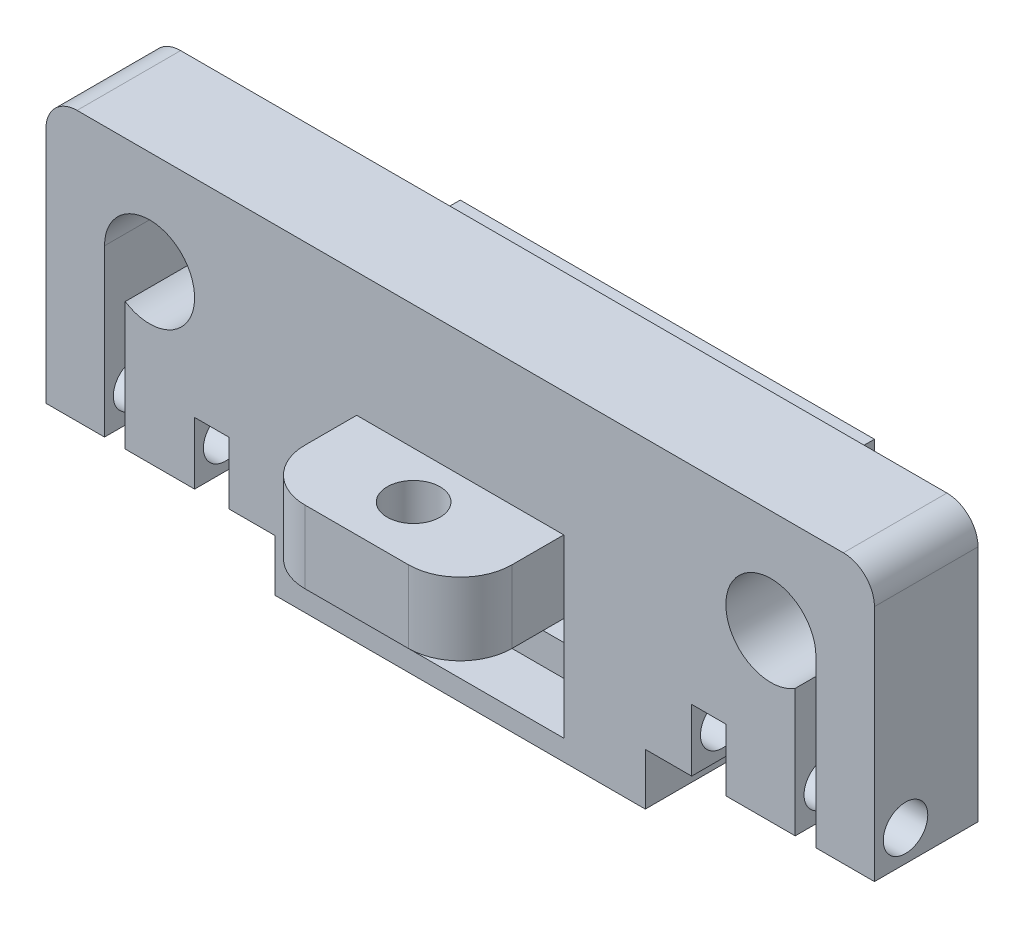
from build123d import *

# Parameters (mm, degrees)
BOSS_EXTRUDE1_DEPTH = 5
SKETCH2_W           = 3.3
SKETCH2_H           = 6
CUT_EXTRUDE2_DEPTH  = 6.5
SKETCH3_R           = 2.15
CUT_EXTRUDE4_DEPTH  = 24
FILLET1_R           = 0.5
FILLET2_R           = 3
SKETCH5_W           = 10.2
SKETCH5_H           = 7
CUT_EXTRUDE5_DEPTH  = 44.231932642
SKETCH8_W           = 20
SKETCH8_H           = 7
CUT_EXTRUDE6_DEPTH  = 44.231932642
SKETCH9_W           = 20
SKETCH9_H           = 7
BOSS_EXTRUDE2_DEPTH = 10
SKETCH10_R          = 2.55
CUT_EXTRUDE7_DEPTH  = 45.955533586
FILLET3_R           = 5
SKETCH11_W          = 40
SKETCH11_H          = 10
BOSS_EXTRUDE3_DEPTH = 10
SKETCH13_W          = 35.742737896
SKETCH13_H          = 10
BOSS_EXTRUDE5_DEPTH = 5
SKETCH14_R          = 1.4
CUT_EXTRUDE8_DEPTH  = 47.75467891
SKETCH16_W          = 20
SKETCH16_H          = 3
CUT_EXTRUDE10_DEPTH = 5
SKETCH17_R          = 1
CUT_EXTRUDE11_DEPTH = 3.5


with BuildPart() as part:
    # Sketch1 → Boss-Extrude1 (new, symmetric)
    with BuildSketch(Plane.XY):
        with BuildLine():
            Line((40, -13), (34.35, -13))
            Line((34.35, -13), (34.35, 3))
            ThreePointArc((34.35, 3), (26.182605601, 5.085665361), (32.35, -0.660601044))
            Line((32.35, -0.660601044), (32.35, -13))
            Line((32.35, -13), (7.5, -13))
            Line((7.5, -13), (7.5, -6))
            Line((7.5, -6), (5.1, -6))
            Line((5.1, -6), (5.1, -13))
            Line((5.1, -13), (-5.1, -13))
            Line((-5.1, -13), (-5.1, -6))
            Line((-5.1, -6), (-7.5, -6))
            Line((-7.5, -6), (-7.5, -13))
            Line((-7.5, -13), (-32.35, -13))
            Line((-32.35, -13), (-32.35, -0.660601044))
            ThreePointArc((-32.35, -0.660601044), (-26.182605601, 5.085665361), (-34.35, 3))
            Line((-34.35, 3), (-34.35, -13))
            Line((-34.35, -13), (-40, -13))
            Line((-40, -13), (-40, 13))
            Line((-40, 13), (40, 13))
            Line((40, 13), (40, -13))
        make_face()
    extrude(amount=BOSS_EXTRUDE1_DEPTH, both=True)

    # Sketch2 → Cut-Extrude2 (cut)
    with BuildSketch(Plane.XY.offset(5)):
        with Locations((-24, -10)):
            Rectangle(SKETCH2_W, SKETCH2_H)
        with Locations((24, -10)):
            Rectangle(SKETCH2_W, SKETCH2_H)
    extrude(amount=-CUT_EXTRUDE2_DEPTH, mode=Mode.SUBTRACT)

    # Sketch3 → Cut-Extrude4 (cut)
    with BuildSketch(Plane.ZY.offset(40)):
        with Locations(Location((2, -10, 0), (0, 0, 90))):
            Circle(SKETCH3_R)
    cut_extrude4 = extrude(amount=-CUT_EXTRUDE4_DEPTH, mode=Mode.SUBTRACT)

    # Mirror1: Cut-Extrude4 across plane
    add(cut_extrude4.mirror(Plane(origin=(0, 0, 0), x_dir=(0, 0, 1), z_dir=(1, 0, 0))), mode=Mode.SUBTRACT)

    # Fillet1
    fillet1_edges = [part.edges().sort_by_distance(p)[0] for p in [
        (5.1, -9.5, -5),
        (-5.1, -9.5, -5),
    ]]
    fillet(fillet1_edges, radius=FILLET1_R)

    # Fillet2
    fillet2_edges = [part.edges().sort_by_distance(p)[0] for p in [
        (-40, 13, 0),
        (40, 13, 0),
    ]]
    fillet(fillet2_edges, radius=FILLET2_R)

    # Sketch5 → Cut-Extrude5 (cut, through all)
    with BuildSketch(Plane.XY.offset(5)):
        with Locations((0, -9.5)):
            Rectangle(SKETCH5_W, SKETCH5_H)
    extrude(amount=-CUT_EXTRUDE5_DEPTH, mode=Mode.SUBTRACT)

    # Sketch8 → Cut-Extrude6 (cut, through all)
    with BuildSketch(Plane(origin=(0, 0, -5), x_dir=(-1, 0, 0), z_dir=(0, 0, -1))):
        with Locations((0, -9.5)):
            Rectangle(SKETCH8_W, SKETCH8_H)
    extrude(amount=-CUT_EXTRUDE6_DEPTH, mode=Mode.SUBTRACT)

    # Sketch9 → Boss-Extrude2 (add)
    with BuildSketch(Plane.XY.offset(5)):
        with Locations((0, -2.5)):
            Rectangle(SKETCH9_W, SKETCH9_H)
    extrude(amount=BOSS_EXTRUDE2_DEPTH)

    # Sketch10 → Cut-Extrude7 (cut, through all)
    with BuildSketch(Plane(origin=(0, 1, 0), x_dir=(1, 0, 0), z_dir=(0, 1, 0))):
        with Locations(Location((0, -9.5, 0), (0, 0, 270))):
            Circle(SKETCH10_R)
    extrude(amount=-CUT_EXTRUDE7_DEPTH, mode=Mode.SUBTRACT)

    # Fillet3
    fillet3_edges = [part.edges().sort_by_distance(p)[0] for p in [
        (-10, -2.5, 15),
        (10, -2.5, 15),
    ]]
    fillet(fillet3_edges, radius=FILLET3_R)

    # Sketch11 → Boss-Extrude3 (add)
    with BuildSketch(Plane(origin=(0, 0, -5), x_dir=(-1, 0, 0), z_dir=(0, 0, -1))):
        with Locations((0, -1)):
            Rectangle(SKETCH11_W, SKETCH11_H)
    extrude(amount=BOSS_EXTRUDE3_DEPTH)

    # Sketch13 → Boss-Extrude5 (add)
    with BuildSketch(Plane.XZ.offset(13)):
        Rectangle(SKETCH13_W, SKETCH13_H)
    extrude(amount=BOSS_EXTRUDE5_DEPTH)

    # Sketch14 → Cut-Extrude8 (cut, through all)
    with BuildSketch(Plane.XZ.offset(6)):
        with Locations((-15, -10)):
            Circle(SKETCH14_R)
        with Locations(Location((15, -10, 0), (0, 0, 270))):
            Circle(SKETCH14_R)
    extrude(amount=-CUT_EXTRUDE8_DEPTH, mode=Mode.SUBTRACT)

    # Sketch16 → Cut-Extrude10 (cut)
    with BuildSketch(Plane.XY.offset(5)):
        with Locations((0, -14.5)):
            Rectangle(SKETCH16_W, SKETCH16_H)
    extrude(amount=-CUT_EXTRUDE10_DEPTH, mode=Mode.SUBTRACT)

    # Sketch17 → Cut-Extrude11 (cut)
    with BuildSketch(Plane.XZ.offset(18)):
        with Locations((-13.871368948, 0)):
            Circle(SKETCH17_R)
        with Locations(Location((13.871368948, 0, 0), (0, 0, 180))):
            Circle(SKETCH17_R)
    extrude(amount=-CUT_EXTRUDE11_DEPTH, mode=Mode.SUBTRACT)


solid = part.part
